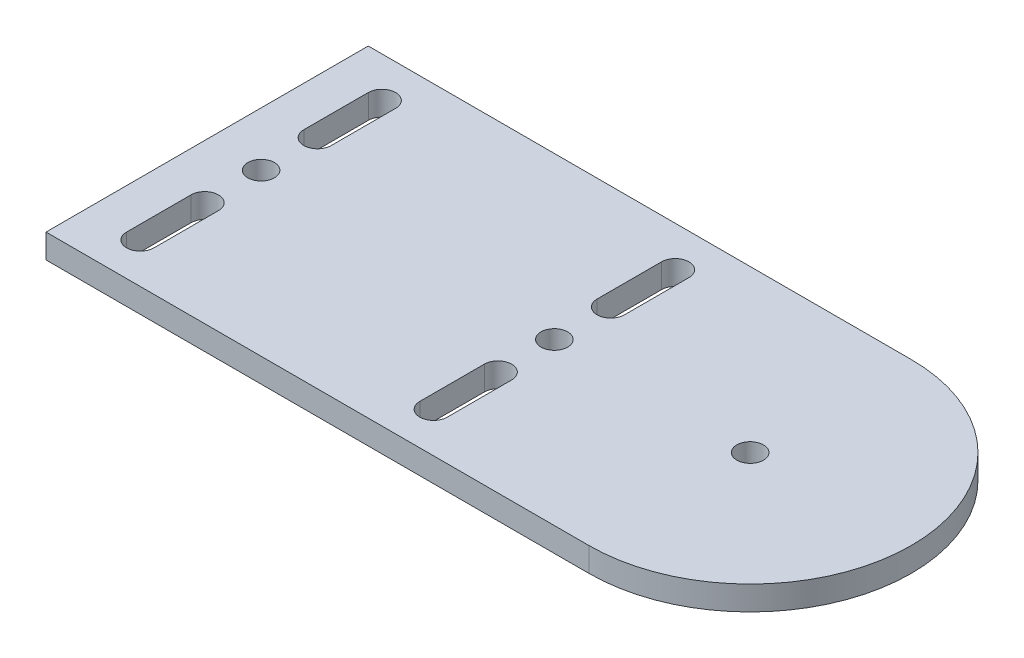
from build123d import *

# Parameters (mm, degrees)
SKETCH_1_R          = 1.65
EXTRUDE_1_DEPTH     = 3
SKETCH_2_R          = 1.65
CUT_EXTRUDE_1_DEPTH = 10
SKETCH_3_W          = 41.485680135
SKETCH_3_H          = 40
CUT_EXTRUDE_2_DEPTH = 10


with BuildPart() as part:
    # 草图1 → 凸台-拉伸1 (new body)
    with BuildSketch(Plane(origin=(0, 0, 0), x_dir=(1, 0, 0), z_dir=(0, 1, 0))):
        with BuildLine():
            Line((0, 20), (85, 20))
            ThreePointArc((85, 20), (105, 0), (85, -20))
            Line((85, -20), (0, -20))
            ThreePointArc((0, -20), (-20, 0), (0, 20))
        make_face()
        with Locations(Location((0, 0, 0), (0, 0, 270))):
            Circle(SKETCH_1_R, mode=Mode.SUBTRACT)
        with Locations(Location((85, 0, 0), (0, 0, 270))):
            Circle(SKETCH_1_R, mode=Mode.SUBTRACT)
        with BuildLine():
            Line((26, 15), (26, 7))
            ThreePointArc((26, 7), (24.3, 5.3), (22.6, 7))
            Line((22.6, 7), (22.6, 15))
            ThreePointArc((22.6, 15), (24.3, 16.7), (26, 15))
        make_face(mode=Mode.SUBTRACT)
        with BuildLine():
            Line((26, -7), (26, -15))
            ThreePointArc((26, -15), (24.3, -16.7), (22.6, -15))
            Line((22.6, -15), (22.6, -7))
            ThreePointArc((22.6, -7), (24.3, -5.3), (26, -7))
        make_face(mode=Mode.SUBTRACT)
        with BuildLine():
            Line((59, -7), (59, -15))
            ThreePointArc((59, -15), (60.7, -16.7), (62.4, -15))
            Line((62.4, -15), (62.4, -7))
            ThreePointArc((62.4, -7), (60.7, -5.3), (59, -7))
        make_face(mode=Mode.SUBTRACT)
        with BuildLine():
            Line((59, 15), (59, 7))
            ThreePointArc((59, 7), (60.7, 5.3), (62.4, 7))
            Line((62.4, 7), (62.4, 15))
            ThreePointArc((62.4, 15), (60.7, 16.7), (59, 15))
        make_face(mode=Mode.SUBTRACT)
    extrude(amount=EXTRUDE_1_DEPTH)

    # 草图2 → 切除-拉伸1 (cut)
    with BuildSketch(Plane(origin=(0, 3, 0), x_dir=(1, 0, 0), z_dir=(0, 1, 0))):
        with Locations(Location((24.3, 0, 0), (0, 0, 270))):
            Circle(SKETCH_2_R)
        with Locations(Location((60.7, 0, 0), (0, 0, 270))):
            Circle(SKETCH_2_R)
    extrude(amount=-CUT_EXTRUDE_1_DEPTH, mode=Mode.SUBTRACT)

    # 草图3 → 切除-拉伸2 (cut)
    with BuildSketch(Plane.XZ):
        with Locations((-3.142840067, 0)):
            Rectangle(SKETCH_3_W, SKETCH_3_H)
    extrude(amount=-CUT_EXTRUDE_2_DEPTH, mode=Mode.SUBTRACT)


solid = part.part
